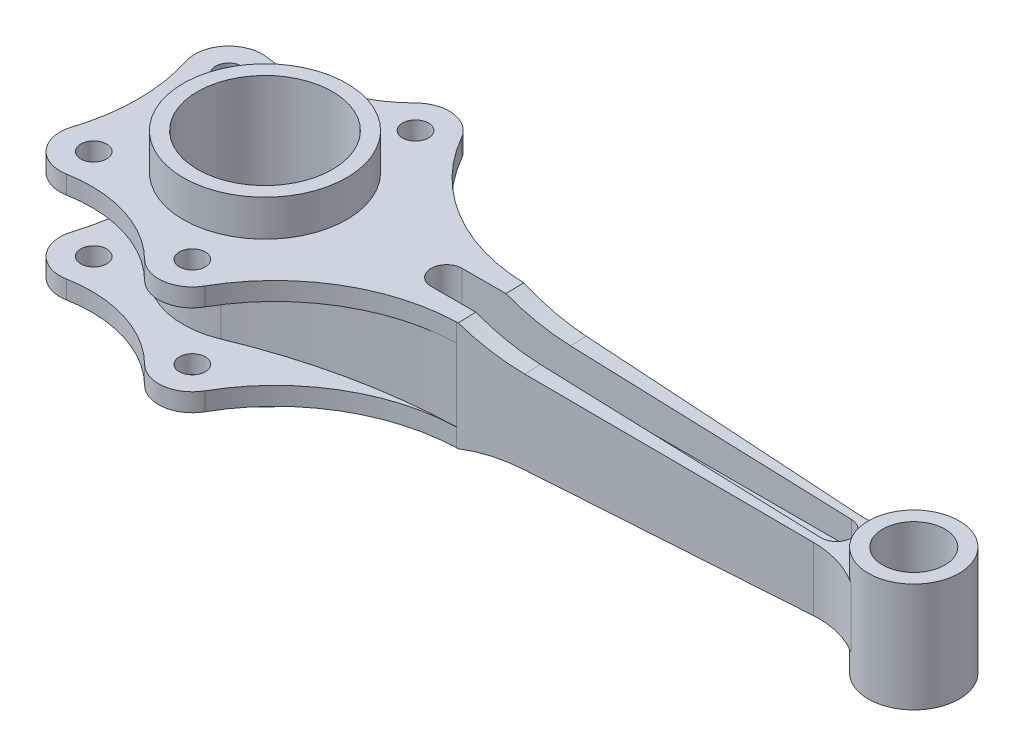
from build123d import *

# Parameters (mm, degrees)
BOSS_EXTRUDE1_DEPTH     = 35
BOSS_EXTRUDE3_START     = 14
BOSS_EXTRUDE3_DEPTH     = 7
BOSS_EXTRUDE4_DEPTH     = 21
CUT_EXTRUDE1_DEPTH      = 203.213347551
CUT_EXTRUDE1_DEPTH_BACK = 203.213347551
BOSS_EXTRUDE5_DEPTH     = 21
CUT_EXTRUDE2_DEPTH      = 18.5
CUT_EXTRUDE3_DEPTH      = 216.030653148
CUT_EXTRUDE3_DEPTH_BACK = 216.030653148
SKETCH4_R               = 5


with BuildPart() as part:
    # Sketch1 → Boss-Extrude1 (new body)
    with BuildSketch(Plane(origin=(0, 0, 0), x_dir=(1, 0, 0), z_dir=(0, 1, 0))):
        with BuildLine():
            ThreePointArc((-160.963685795, 32.158009367), (-134.963685795, 58.158009367), (-108.963685795, 32.158009367))
            Line((-108.963685795, 32.158009367), (-103.463685795, 32.158009367))
            ThreePointArc((-103.463685795, 32.158009367), (-108.757646875, 49.636382407), (-122.860100026, 61.239845821))
            ThreePointArc((-122.860100026, 61.239845821), (-152.442058835, 58.364048287), (-166.463685795, 32.158009367))
            Line((-166.463685795, 32.158009367), (-160.963685795, 32.158009367))
        make_face()
        with BuildLine():
            Line((-103.463685795, 32.158009367), (-108.963685795, 32.158009367))
            ThreePointArc((-108.963685795, 32.158009367), (-134.963685795, 6.158009367), (-160.963685795, 32.158009367))
            Line((-160.963685795, 32.158009367), (-166.463685795, 32.158009367))
            ThreePointArc((-166.463685795, 32.158009367), (-152.442058835, 5.951970447), (-122.860100026, 3.076172913))
            ThreePointArc((-122.860100026, 3.076172913), (-108.757646875, 14.679636327), (-103.463685795, 32.158009367))
        make_face()
        with BuildLine():
            ThreePointArc((-160.963685795, 32.158009367), (-134.963685795, 58.158009367), (-108.963685795, 32.158009367))
            Line((-108.963685795, 32.158009367), (-103.463685795, 32.158009367))
            ThreePointArc((-103.463685795, 32.158009367), (-108.757646875, 49.636382407), (-122.860100026, 61.239845821))
            ThreePointArc((-122.860100026, 61.239845821), (-152.442058835, 58.364048287), (-166.463685795, 32.158009367))
            Line((-166.463685795, 32.158009367), (-160.963685795, 32.158009367))
        make_face()
        with BuildLine():
            Line((-103.463685795, 32.158009367), (-108.963685795, 32.158009367))
            ThreePointArc((-108.963685795, 32.158009367), (-134.963685795, 6.158009367), (-160.963685795, 32.158009367))
            Line((-160.963685795, 32.158009367), (-166.463685795, 32.158009367))
            ThreePointArc((-166.463685795, 32.158009367), (-152.442058835, 5.951970447), (-122.860100026, 3.076172913))
            ThreePointArc((-122.860100026, 3.076172913), (-108.757646875, 14.679636327), (-103.463685795, 32.158009367))
        make_face()
    extrude(amount=BOSS_EXTRUDE1_DEPTH)

    # Sketch1<5> → Boss-Extrude3 (add)
    with BuildSketch(Plane(origin=(0, 0, 0), x_dir=(1, 0, 0), z_dir=(0, 1, 0)).offset(BOSS_EXTRUDE3_START)):
        with BuildLine():
            ThreePointArc((-122.860100026, 61.239845821), (-86.266022188, 49.78848691), (-48.202669322, 45.158009367))
            ThreePointArc((-48.202669322, 45.158009367), (-83.19912964, 55.451565304), (-108.65874531, 81.576601162))
            ThreePointArc((-108.65874531, 81.576601162), (-118.188423055, 88.036225168), (-129.110384746, 84.395860758))
            ThreePointArc((-129.110384746, 84.395860758), (-149.219583948, 72.338856333), (-172.624945232, 70.945905698))
            ThreePointArc((-172.624945232, 70.945905698), (-184.733648255, 66.734012722), (-187.340586928, 54.181538779))
            ThreePointArc((-187.340586928, 54.181538779), (-183.88957782, 32.158009367), (-187.340586928, 10.134479955))
            ThreePointArc((-187.340586928, 10.134479955), (-184.733648255, -2.417993988), (-172.624945232, -6.629886964))
            ThreePointArc((-172.624945232, -6.629886964), (-149.219583948, -8.022837599), (-129.110384746, -20.079842023))
            ThreePointArc((-129.110384746, -20.079842023), (-118.188423055, -23.720206433), (-108.65874531, -17.260582428))
            ThreePointArc((-108.65874531, -17.260582428), (-83.19912964, 8.86445343), (-48.202669322, 19.158009367))
            ThreePointArc((-48.202669322, 19.158009367), (-86.266022188, 14.527531824), (-122.860100026, 3.076172913))
            ThreePointArc((-122.860100026, 3.076172913), (-166.463685795, 32.158009367), (-122.860100026, 61.239845821))
        make_face()
    extrude(amount=BOSS_EXTRUDE3_DEPTH)

    # Sketch1<7> → Boss-Extrude4 (add)
    with BuildSketch(Plane(origin=(0, 0, 0), x_dir=(1, 0, 0), z_dir=(0, 1, 0))):
        with BuildLine():
            Line((97.536314205, 32.158009367), (-103.463685795, 32.158009367))
            ThreePointArc((-103.463685795, 32.158009367), (-108.757646875, 14.679636327), (-122.860100026, 3.076172913))
            ThreePointArc((-122.860100026, 3.076172913), (-86.266022188, 14.527531824), (-48.202669322, 19.158009367))
            Line((-48.202669322, 19.158009367), (85.324203099, 23.158009367))
            ThreePointArc((85.324203099, 23.158009367), (95.83616648, 21.869898036), (105.481613155, 17.496573972))
            ThreePointArc((105.481613155, 17.496573972), (99.650325963, 23.820062029), (97.536314205, 32.158009367))
        make_face()
        with BuildLine():
            ThreePointArc((-122.860100026, 61.239845821), (-108.757646875, 49.636382407), (-103.463685795, 32.158009367))
            Line((-103.463685795, 32.158009367), (97.536314205, 32.158009367))
            ThreePointArc((97.536314205, 32.158009367), (99.650325963, 40.495956705), (105.481613155, 46.819444762))
            ThreePointArc((105.481613155, 46.819444762), (95.83616648, 42.446120698), (85.324203099, 41.158009367))
            Line((85.324203099, 41.158009367), (-48.202669322, 45.158009367))
            ThreePointArc((-48.202669322, 45.158009367), (-86.266022188, 49.78848691), (-122.860100026, 61.239845821))
        make_face()
    extrude(amount=BOSS_EXTRUDE4_DEPTH)

    # Sketch2 → Cut-Extrude1 (cut, two sides: drawn at the far end of the back side and taken through both)
    with BuildSketch(Plane(origin=(-0.616610621, 0, -20.583521935), x_dir=(0.9995516053170144, 0, -0.029943084480054463), z_dir=(0.02994308448005446, 0, 0.9995516053170143)).offset(-CUT_EXTRUDE1_DEPTH_BACK)):
        Polygon((-46.940258805, 23.404897351), (-46.940258805, 21), (85.979366411, 21), (85.979366411, 12.228337878), (106.836234351, 11.5), (106.836234351, 19.899284572), (106.836234351, 23.404897351), align=None)
        with BuildLine():
            Line((85.979366411, 21), (-46.940258805, 21))
            ThreePointArc((-46.940258805, 21), (-34.706035561, 17.482188037), (-22.062538217, 16.001244325))
            Line((-22.062538217, 16.001244325), (85.979366411, 12.228337878))
            Line((85.979366411, 12.228337878), (85.979366411, 21))
        make_face()
    extrude(amount=CUT_EXTRUDE1_DEPTH + CUT_EXTRUDE1_DEPTH_BACK, mode=Mode.SUBTRACT)

    # Sketch1<8> → Boss-Extrude5 (add)
    with BuildSketch(Plane(origin=(0, 0, 0), x_dir=(1, 0, 0), z_dir=(0, 1, 0))):
        with BuildLine():
            ThreePointArc((105.481613155, 46.819444762), (99.650325963, 40.495956705), (97.536314205, 32.158009367))
            Line((97.536314205, 32.158009367), (103.036314205, 32.158009367))
            ThreePointArc((103.036314205, 32.158009367), (115.036314205, 44.158009367), (127.036314205, 32.158009367))
            Line((127.036314205, 32.158009367), (132.536314205, 32.158009367))
            ThreePointArc((132.536314205, 32.158009367), (123.374261543, 47.543997609), (105.481613155, 46.819444762))
        make_face()
        with BuildLine():
            Line((103.036314205, 32.158009367), (97.536314205, 32.158009367))
            ThreePointArc((97.536314205, 32.158009367), (99.650325963, 23.820062029), (105.481613155, 17.496573972))
            ThreePointArc((105.481613155, 17.496573972), (123.374261543, 16.772021125), (132.536314205, 32.158009367))
            Line((132.536314205, 32.158009367), (127.036314205, 32.158009367))
            ThreePointArc((127.036314205, 32.158009367), (115.036314205, 20.158009367), (103.036314205, 32.158009367))
        make_face()
        with BuildLine():
            ThreePointArc((105.481613155, 46.819444762), (99.650325963, 40.495956705), (97.536314205, 32.158009367))
            Line((97.536314205, 32.158009367), (103.036314205, 32.158009367))
            ThreePointArc((103.036314205, 32.158009367), (115.036314205, 44.158009367), (127.036314205, 32.158009367))
            Line((127.036314205, 32.158009367), (132.536314205, 32.158009367))
            ThreePointArc((132.536314205, 32.158009367), (123.374261543, 47.543997609), (105.481613155, 46.819444762))
        make_face()
        with BuildLine():
            Line((103.036314205, 32.158009367), (97.536314205, 32.158009367))
            ThreePointArc((97.536314205, 32.158009367), (99.650325963, 23.820062029), (105.481613155, 17.496573972))
            ThreePointArc((105.481613155, 17.496573972), (123.374261543, 16.772021125), (132.536314205, 32.158009367))
            Line((132.536314205, 32.158009367), (127.036314205, 32.158009367))
            ThreePointArc((127.036314205, 32.158009367), (115.036314205, 20.158009367), (103.036314205, 32.158009367))
        make_face()
    extrude(amount=BOSS_EXTRUDE5_DEPTH)

    # Mirror1: part across plane


with BuildPart() as part_1:
    add(part.part)
    add(part.part.mirror(Plane.ZX))

    # Sketch3 → Cut-Extrude2 (cut)
    with BuildSketch(Plane(origin=(0, 21, 0), x_dir=(1, 0, 0), z_dir=(0, 1, 0))):
        with BuildLine():
            Line((85.036314205, 26.158009367), (-64.963685795, 26.158009367))
            ThreePointArc((-64.963685795, 26.158009367), (-70.963685795, 32.158009367), (-64.963685795, 38.158009367))
            Line((-64.963685795, 38.158009367), (85.036314205, 38.158009367))
            ThreePointArc((85.036314205, 38.158009367), (91.036314205, 32.158009367), (85.036314205, 26.158009367))
        make_face()
    cut_extrude2 = extrude(amount=-CUT_EXTRUDE2_DEPTH, mode=Mode.SUBTRACT)

    # Mirror2: Cut-Extrude2 across plane
    add(cut_extrude2.mirror(Plane.ZX), mode=Mode.SUBTRACT)

    # Sketch4 → Cut-Extrude3 (cut, two sides: drawn at the far end of the back side and taken through both)
    with BuildSketch(Plane(origin=(0, 21, 0), x_dir=(1, 0, 0), z_dir=(0, 1, 0)).offset(-CUT_EXTRUDE3_DEPTH_BACK)):
        with Locations(Location((-174.963685795, 58.158009367, 0), (0, 0, 90))):
            Circle(SKETCH4_R)
        with Locations(Location((-174.963685795, 6.158009367, 0), (0, 0, 90))):
            Circle(SKETCH4_R)
        with Locations(Location((-119.963685795, -10.841990633, 0), (0, 0, 90))):
            Circle(SKETCH4_R)
        with Locations(Location((-119.963685795, 75.158009367, 0), (0, 0, 90))):
            Circle(SKETCH4_R)
    extrude(amount=CUT_EXTRUDE3_DEPTH + CUT_EXTRUDE3_DEPTH_BACK, mode=Mode.SUBTRACT)


solid = part_1.part
